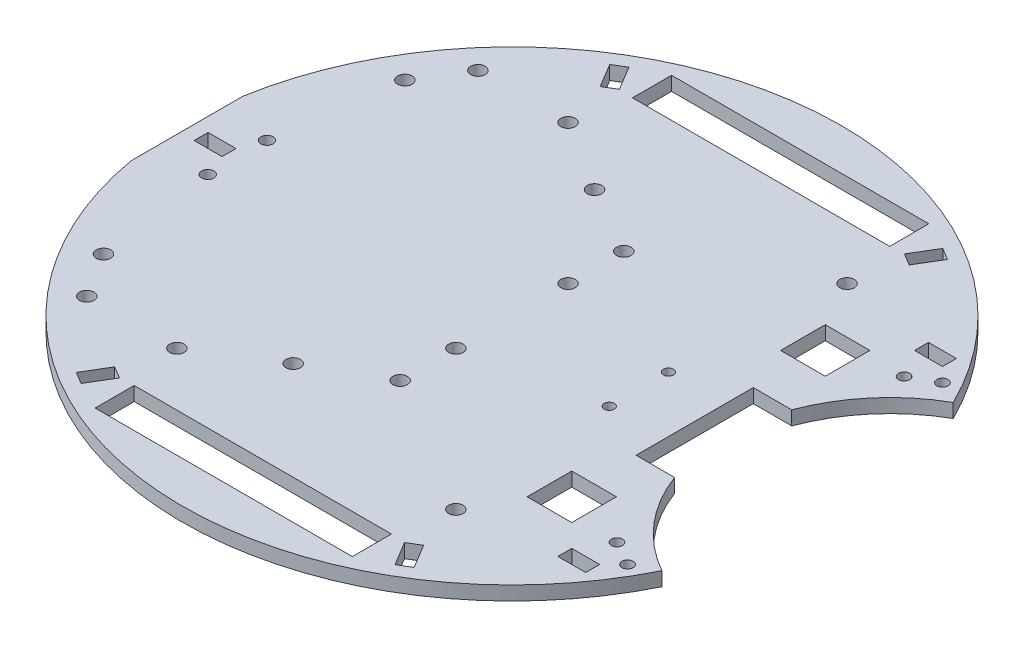
from build123d import *

# Parameters (mm, degrees)
SKETCH1_R           = 1.397
SKETCH1_R_2         = 1.651
SKETCH1_R_3         = 1.143
SKETCH1_R_4         = 1.27
SKETCH1_W           = 58.544107304
SKETCH1_H           = 8.89
SKETCH1_W_2         = 6.35
SKETCH1_H_2         = 3.175
SKETCH1_W_3         = 10.16
SKETCH1_H_3         = 10.16
BOSS_EXTRUDE1_DEPTH = 3.175


with BuildPart() as part:
    # Sketch1 → Boss-Extrude1 (new body)
    with BuildSketch(Plane(origin=(0, 0, 0), x_dir=(1, 0, 0), z_dir=(0, 1, 0))):
        with BuildLine():
            Line((50.342102347, 13.335), (41.582265908, 13.335))
            Line((41.582265908, 13.335), (41.582265908, -13.335))
            Line((41.582265908, -13.335), (50.342102347, -13.335))
            ThreePointArc((50.342102347, -13.335), (52.41895011, -17.937530518), (55.086193863, -22.225))
            ThreePointArc((55.086193863, -22.225), (60.584216496, -28.355013333), (67.270928268, -33.160552015))
            ThreePointArc((67.270928268, -33.160552015), (-10.756431789, -74.224653419), (-73.916912814, -12.7))
            Line((-73.916912814, -12.7), (-73.916912814, 12.7))
            ThreePointArc((-73.916912814, 12.7), (-10.756431789, 74.224653419), (67.270928268, 33.160552015))
            ThreePointArc((67.270928268, 33.160552015), (57.058059725, 24.74076345), (50.342102347, 13.335))
        make_face()
        with Locations(Location((-62.486912814, 6.731, 0), (0, 0, 270))):
            Circle(SKETCH1_R, mode=Mode.SUBTRACT)
        with Locations(Location((-62.486912814, -6.731, 0), (0, 0, 270))):
            Circle(SKETCH1_R, mode=Mode.SUBTRACT)
        with Locations(Location((-31.75, -44.507461806, 0), (0, 0, 270))):
            Circle(SKETCH1_R_2, mode=Mode.SUBTRACT)
        with Locations(Location((31.75, -44.507461806, 0), (0, 0, 270))):
            Circle(SKETCH1_R_2, mode=Mode.SUBTRACT)
        with Locations(Location((31.75, 44.507461806, 0), (0, 0, 90))):
            Circle(SKETCH1_R_2, mode=Mode.SUBTRACT)
        with Locations(Location((0, -12.757461806, 0), (0, 0, 270))):
            Circle(SKETCH1_R_2, mode=Mode.SUBTRACT)
        with Locations(Location((-31.75, 44.507461806, 0), (0, 0, 90))):
            Circle(SKETCH1_R_2, mode=Mode.SUBTRACT)
        with Locations(Location((0, 12.757461806, 0), (0, 0, 90))):
            Circle(SKETCH1_R_2, mode=Mode.SUBTRACT)
        with Locations(Location((28.882265908, 6.731, 0), (0, 0, 270))):
            Circle(SKETCH1_R_3, mode=Mode.SUBTRACT)
        with Locations(Location((-58.676912814, 34.29, 0), (0, 0, 270))):
            Circle(SKETCH1_R_2, mode=Mode.SUBTRACT)
        with Locations(Location((62.141053559, -35.830642926, 0), (0, 0, 270))):
            Circle(SKETCH1_R_4, mode=Mode.SUBTRACT)
        with Locations(Location((56.570777105, -32.679132142, 0), (0, 0, 270))):
            Circle(SKETCH1_R_4, mode=Mode.SUBTRACT)
        with Locations(Location((-58.676912814, -34.29, 0), (0, 0, 270))):
            Circle(SKETCH1_R_2, mode=Mode.SUBTRACT)
        with Locations(Location((28.882265908, -6.731, 0), (0, 0, 270))):
            Circle(SKETCH1_R_3, mode=Mode.SUBTRACT)
        with Locations(Location((0, -25.457461806, 0), (0, 0, 270))):
            Circle(SKETCH1_R_2, mode=Mode.SUBTRACT)
        with Locations(Location((56.570777105, 32.679132142, 0), (0, 0, 90))):
            Circle(SKETCH1_R_4, mode=Mode.SUBTRACT)
        with Locations(Location((62.141053559, 35.830642926, 0), (0, 0, 90))):
            Circle(SKETCH1_R_4, mode=Mode.SUBTRACT)
        with Locations(Location((0, 25.457461806, 0), (0, 0, 90))):
            Circle(SKETCH1_R_2, mode=Mode.SUBTRACT)
        with Locations(Location((-15.496912814, 34.29, 0), (0, 0, 270))):
            Circle(SKETCH1_R_2, mode=Mode.SUBTRACT)
        with Locations(Location((-15.496912814, -34.29, 0), (0, 0, 270))):
            Circle(SKETCH1_R_2, mode=Mode.SUBTRACT)
        with Locations(Location((-52.26766059, -44.507461806, 0), (0, 0, 270))):
            Circle(SKETCH1_R_2, mode=Mode.SUBTRACT)
        with Locations(Location((-52.26766059, 44.507461806, 0), (0, 0, 270))):
            Circle(SKETCH1_R_2, mode=Mode.SUBTRACT)
        with Locations((0, -61.144461806)):
            Rectangle(SKETCH1_W, SKETCH1_H, mode=Mode.SUBTRACT)
        with Locations((0, 61.144461806)):
            Rectangle(SKETCH1_W, SKETCH1_H, mode=Mode.SUBTRACT)
        with Locations((55.791053559, -40.593142926)):
            Rectangle(SKETCH1_W_2, SKETCH1_H_2, mode=Mode.SUBTRACT)
        with Locations((55.791053559, 40.593142926)):
            Rectangle(SKETCH1_W_2, SKETCH1_H_2, mode=Mode.SUBTRACT)
        with Locations((42.456053559, 28.845642926)):
            Rectangle(SKETCH1_W_3, SKETCH1_H_3, mode=Mode.SUBTRACT)
        with Locations((42.456053559, -28.845642926)):
            Rectangle(SKETCH1_W_3, SKETCH1_H_3, mode=Mode.SUBTRACT)
        Polygon((32.44100721, -56.895314679), (35.719111901, -62.333745485), (38.438327304, -60.694693139), (35.160222613, -55.256262334), align=None, mode=Mode.SUBTRACT)
        Polygon((-32.44100721, -56.895314679), (-35.160222613, -55.256262334), (-38.438327304, -60.694693139), (-35.719111901, -62.333745485), align=None, mode=Mode.SUBTRACT)
        Polygon((-35.160222613, 55.256262334), (-38.438327304, 60.694693139), (-35.719111901, 62.333745485), (-32.44100721, 56.895314679), align=None, mode=Mode.SUBTRACT)
        Polygon((35.160222613, 55.256262334), (38.438327304, 60.694693139), (35.719111901, 62.333745485), (32.44100721, 56.895314679), align=None, mode=Mode.SUBTRACT)
        with Locations((-67.566912814, 0)):
            Rectangle(SKETCH1_W_2, SKETCH1_H_2, mode=Mode.SUBTRACT)
    extrude(amount=BOSS_EXTRUDE1_DEPTH)


solid = part.part
